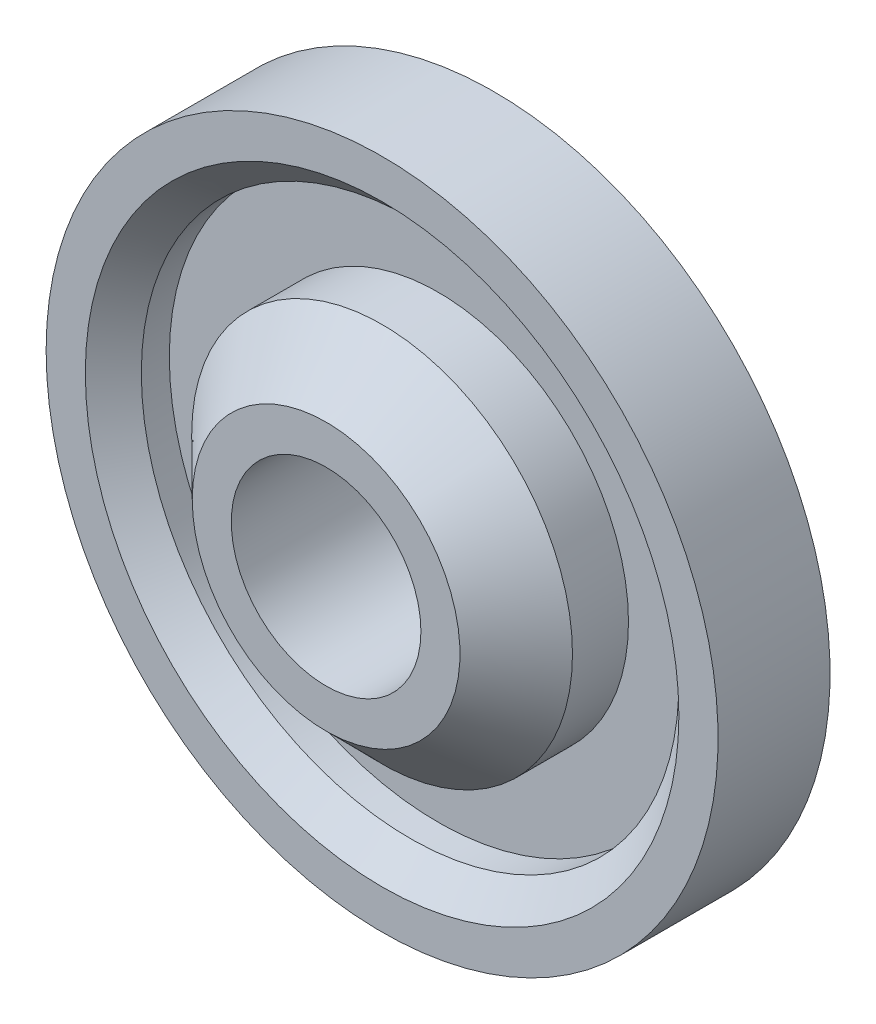
from build123d import *

# Parameters (mm, degrees)
SKETCH2_R          = 1.6933
CUT_EXTRUDE1_DEPTH = 10


with BuildPart() as part:
    # Sketch1 → Revolve1 (revolve)
    with BuildSketch(Plane(origin=(0, 0, 0), x_dir=(1, 0, 0), z_dir=(0, 1, 0)), mode=Mode.PRIVATE) as revolve1_sk:
        Polygon((0, 0), (6, 0), (6, -2), (5.3, -2), (4.8, -1.5), (4.8, -1), (3.4, -1), (3.4, -2), (2.39055, -3), (0, -3), align=None)
    revolve(revolve1_sk.sketch.rotate(Axis((0, 0, 0), (0, 0, 1)), 180), axis=Axis((0, 0, 0), (0, 0, 1)))

    # Sketch2 → Cut-Extrude1 (cut, through all)
    with BuildSketch(Plane.XY.offset(3)):
        Circle(SKETCH2_R)
    extrude(amount=-CUT_EXTRUDE1_DEPTH, mode=Mode.SUBTRACT)


solid = part.part
